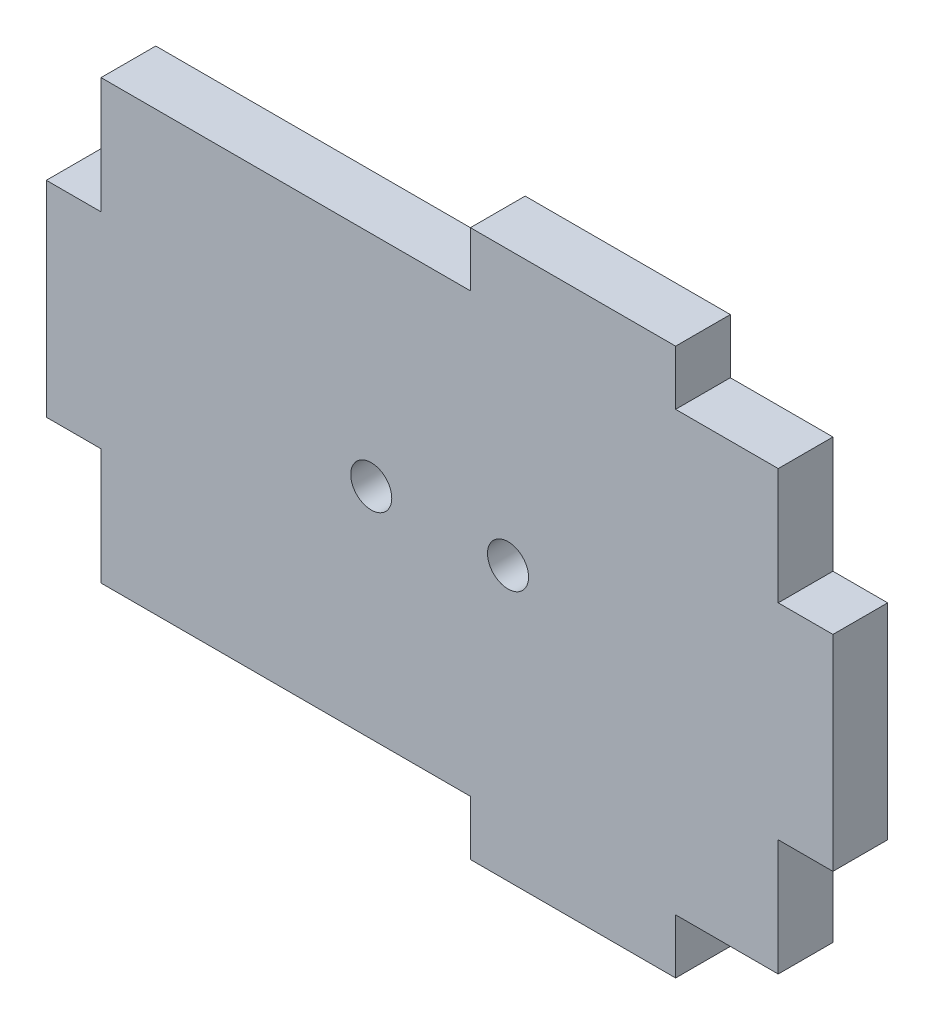
from build123d import *

# Parameters (mm, degrees)
SKETCH_1_R      = 1.5
EXTRUDE_1_DEPTH = 4


with BuildPart() as part:
    # Эскиз1 → Бобышка-Вытянуть1 (new body)
    with BuildSketch(Plane.XY):
        Polygon((27, 32), (27, 36), (42, 36), (42, 32), (49.5, 32), (49.5, 23.5), (53.5, 23.5), (53.5, 8.5), (49.5, 8.5), (49.5, 0), (42, 0), (42, -4), (27, -4), (27, 0), (0, 0), (0, 8.5), (-4, 8.5), (-4, 23.5), (0, 23.5), (0, 32), align=None)
        with Locations((19.75, 16)):
            Circle(SKETCH_1_R, mode=Mode.SUBTRACT)
        with Locations(Location((29.75, 16, 0), (0, 0, 180))):
            Circle(SKETCH_1_R, mode=Mode.SUBTRACT)
    extrude(amount=EXTRUDE_1_DEPTH)


solid = part.part
